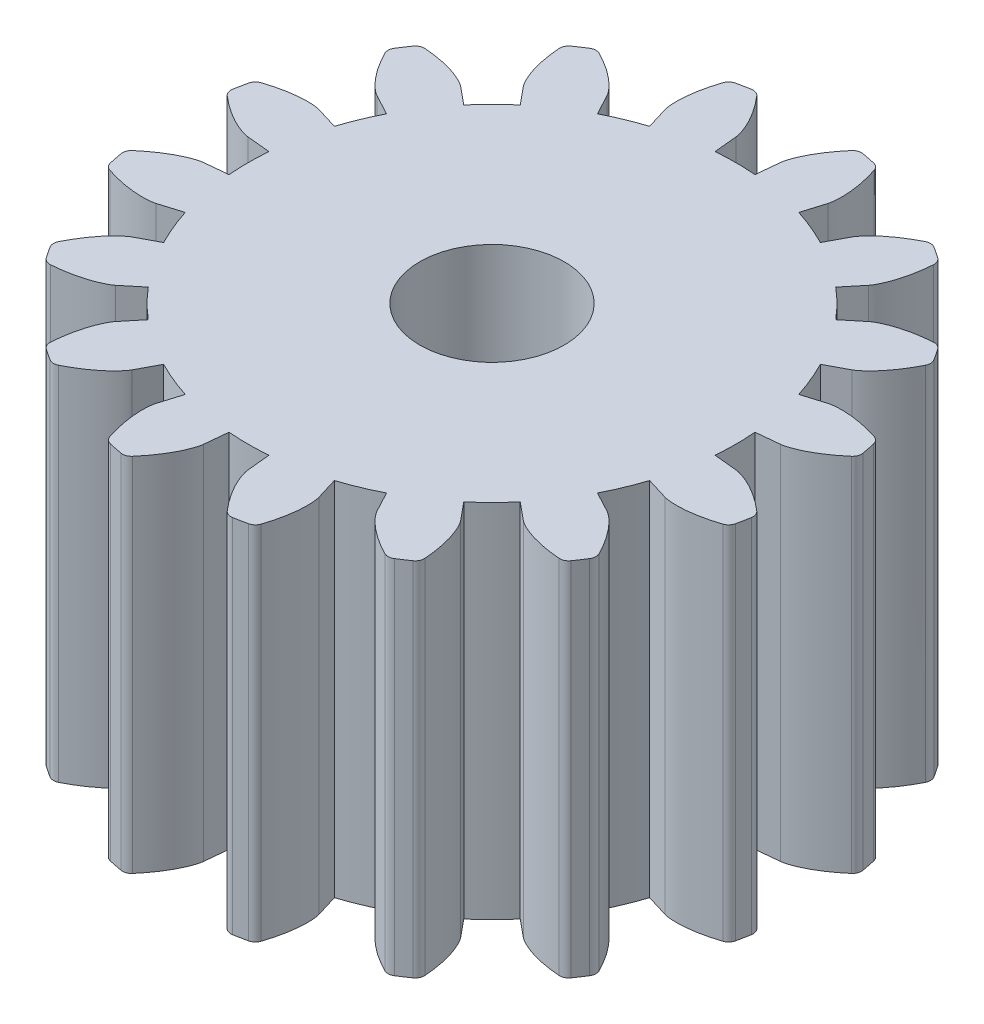
from build123d import *

# Parameters (mm, degrees)
SKETCH4_R                = 9
BOSS_EXTRUDE2_DEPTH      = 10.16
SKETCH6_R                = 2.032
CUT_EXTRUDE1_DEPTH       = 10.16
CUT_EXTRUDE2_DEPTH       = 17.285748371
FILLET1_R                = 0.254
FILLET2_R                = 0.254
CIRPATTERN1_COUNT        = 16
FILLET1_OF_CIRPATTERN1_R = 0.254
FILLET2_OF_CIRPATTERN1_R = 0.254


with BuildPart() as part:
    # Sketch4 → Boss-Extrude2 (new body)
    with BuildSketch(Plane(origin=(0, 0, 0), x_dir=(1, 0, 0), z_dir=(0, 1, 0))):
        with Locations(Location((0, 0, 0), (0, 0, 270))):
            Circle(SKETCH4_R)
    extrude(amount=BOSS_EXTRUDE2_DEPTH)

    # Sketch6 → Cut-Extrude1 (cut)
    with BuildSketch(Plane(origin=(0, 10.16, 0), x_dir=(1, 0, 0), z_dir=(0, 1, 0))):
        with Locations(Location((0, 0, 0), (0, 0, 270))):
            Circle(SKETCH6_R)
    extrude(amount=-CUT_EXTRUDE1_DEPTH, mode=Mode.SUBTRACT)

    # Sketch7 → Cut-Extrude2 (cut, through all)
    with BuildSketch(Plane(origin=(0, 10.16, 0), x_dir=(1, 0, 0), z_dir=(0, 1, 0))):
        with BuildLine():
            Line((7.491492869, 0.625265363), (6.834995033, 0.561254752))
            ThreePointArc((6.834995033, 0.561254752), (6.858, 0), (6.834995033, -0.561254752))
            Line((6.834995033, -0.561254752), (7.491492869, -0.625265363))
            add(Edge.make_bspline(
                [(7.491492869, -0.625265363), (7.493889838, -0.625499075), (7.500602603, -0.626257953), (7.521265733, -0.629268246), (7.56179024, -0.637077914), (7.611417674, -0.649396251), (7.668024527, -0.666104037), (7.722240729, -0.68422142), (7.768321098, -0.700942696), (7.814016263, -0.718763829), (7.859279237, -0.737542457), (7.913785845, -0.761495784), (7.978686056, -0.791891784), (8.053829051, -0.829840761), (8.138172023, -0.875724584), (8.223125587, -0.925500387), (8.305871711, -0.976946684), (8.388438772, -1.031731521), (8.467587692, -1.086724939), (8.548663818, -1.146679757), (8.622928724, -1.203466031), (8.704808016, -1.27018235), (8.77050425, -1.324930645), (8.837219621, -1.384037714), (8.869518828, -1.413180608), (8.885952605, -1.428231879)],
                knots=[0, 0, 0, 0, 0, 0.005376749, 0.015083688, 0.04661014, 0.092110526, 0.119476176, 0.146842496, 0.174208854, 0.201574956, 0.228941013, 0.256307345, 0.307035032, 0.361767352, 0.416499661, 0.471231937, 0.525964282, 0.580696616, 0.635428982, 0.690161387, 0.744893688, 0.799626082, 0.854358408, 0.909090915, 0.909090915, 0.909090915, 0.909090915, 0.909090915], degree=4))
            ThreePointArc((8.885952605, -1.428231879), (9.047203619, -0.723020509), (9.071000892, 0))
            ThreePointArc((9.071000892, 0), (9.047203619, 0.723020509), (8.885952605, 1.428231879))
            add(Edge.make_bspline(
                [(7.491492869, 0.625265363), (7.493889838, 0.625499075), (7.500602603, 0.626257953), (7.521265733, 0.629268246), (7.56179024, 0.637077914), (7.611417674, 0.649396251), (7.668024527, 0.666104037), (7.722240729, 0.68422142), (7.768321098, 0.700942696), (7.814016263, 0.718763829), (7.859279237, 0.737542457), (7.913785845, 0.761495783), (7.978686056, 0.791891784), (8.053829051, 0.829840761), (8.138172023, 0.875724584), (8.223125587, 0.925500387), (8.305871711, 0.976946684), (8.388438772, 1.031731521), (8.467587692, 1.086724939), (8.548663818, 1.146679757), (8.622928724, 1.203466031), (8.704808016, 1.27018235), (8.77050425, 1.324930645), (8.837219621, 1.384037714), (8.869518828, 1.413180608), (8.885952605, 1.428231879)],
                knots=[0, 0, 0, 0, 0, 0.005376749, 0.015083688, 0.04661014, 0.092110526, 0.119476176, 0.146842496, 0.174208854, 0.201574956, 0.228941013, 0.256307345, 0.307035032, 0.361767352, 0.416499661, 0.471231937, 0.525964282, 0.580696616, 0.635428982, 0.690161387, 0.744893688, 0.799626082, 0.854358408, 0.909090915, 0.909090915, 0.909090915, 0.909090915, 0.909090915], degree=4))
        make_face()
    cut_extrude2 = extrude(amount=-CUT_EXTRUDE2_DEPTH, mode=Mode.SUBTRACT)

    # Fillet1
    fillet1_edges = [part.edges().sort_by_distance(p)[0] for p in [
        (8.885952605, 5.08, -1.428231879),
    ]]
    fillet(fillet1_edges, radius=FILLET1_R)

    # Fillet2
    fillet2_edges = [part.edges().sort_by_distance(p)[0] for p in [
        (8.885952605, 5.08, 1.428231879),
    ]]
    fillet(fillet2_edges, radius=FILLET2_R)

    # CirPattern1: Cut-Extrude2 ×16 about axis
    cirpattern1_axis = Axis((0, 10.16, 0), (0, 1, 0))
    for i in range(1, CIRPATTERN1_COUNT):
        add(cut_extrude2.rotate(cirpattern1_axis, i * 360 / CIRPATTERN1_COUNT), mode=Mode.SUBTRACT)

    # Fillet1 of CirPattern1
    fillet1_of_cirpattern1_edges = [part.edges().sort_by_distance(p)[0] for p in [
        (7.662989061, 5.08, -4.720021043),
        (5.273404898, 5.08, -7.293229791),
        (2.080992642, 5.08, -8.756110416),
        (-1.428231879, 5.08, -8.885952605),
        (-4.720021043, 5.08, -7.662989061),
        (-7.293229791, 5.08, -5.273404898),
        (-8.756110416, 5.08, -2.080992642),
        (-8.885952605, 5.08, 1.428231879),
        (-7.662989061, 5.08, 4.720021043),
        (-5.273404898, 5.08, 7.293229791),
        (-2.080992642, 5.08, 8.756110416),
        (1.428231879, 5.08, 8.885952605),
        (4.720021043, 5.08, 7.662989061),
        (7.293229791, 5.08, 5.273404898),
        (8.756110416, 5.08, 2.080992642),
    ]]
    fillet(fillet1_of_cirpattern1_edges, radius=FILLET1_OF_CIRPATTERN1_R)

    # Fillet2 of CirPattern1
    fillet2_of_cirpattern1_edges = [part.edges().sort_by_distance(p)[0] for p in [
        (8.756110416, 5.08, -2.080992642),
        (7.293229791, 5.08, -5.273404898),
        (4.720021043, 5.08, -7.662989061),
        (1.428231879, 5.08, -8.885952605),
        (-2.080992642, 5.08, -8.756110416),
        (-5.273404898, 5.08, -7.293229791),
        (-7.662989061, 5.08, -4.720021043),
        (-8.885952605, 5.08, -1.428231879),
        (-8.756110416, 5.08, 2.080992642),
        (-7.293229791, 5.08, 5.273404898),
        (-4.720021043, 5.08, 7.662989061),
        (-1.428231879, 5.08, 8.885952605),
        (2.080992642, 5.08, 8.756110416),
        (5.273404898, 5.08, 7.293229791),
        (7.662989061, 5.08, 4.720021043),
    ]]
    fillet(fillet2_of_cirpattern1_edges, radius=FILLET2_OF_CIRPATTERN1_R)


solid = part.part
